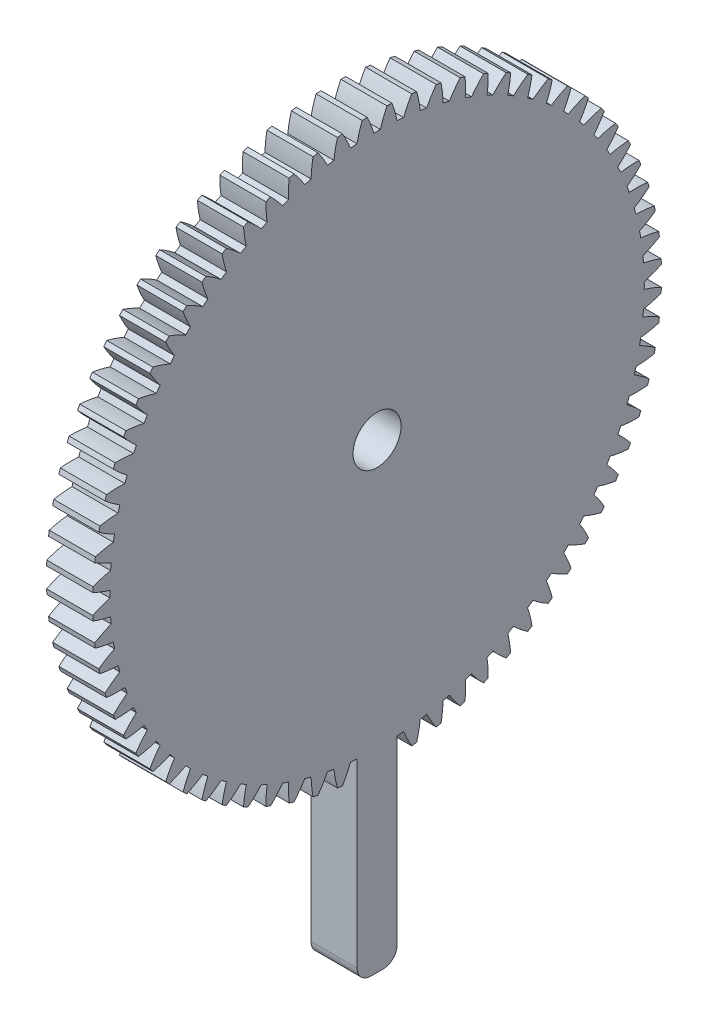
from build123d import *

# Parameters (mm, degrees)
SKETCH1_W           = 6.35
SKETCH1_H           = 39.158333333
CUT_EXTRUDE1_DEPTH  = 56.741121615
SKETCH5_R           = 3.302
CUT_EXTRUDE3_DEPTH  = 56.70763123
BOSS_EXTRUDE1_DEPTH = 6.35


with BuildPart() as part:
    # Sketch1 → Revolve1 (revolve)
    with BuildSketch(Plane.XY, mode=Mode.PRIVATE) as revolve1_sk:
        with Locations((3.175, 19.579166667)):
            Rectangle(SKETCH1_W, SKETCH1_H)
    revolve(revolve1_sk.sketch.rotate(Axis((-10, 0, 0), (1, 0, 0)), 90), axis=Axis((-10, 0, 0), (1, 0, 0)))

    # Sketch2 → Cut-Extrude1 (cut, through all)
    with BuildSketch(Plane.ZY):
        with BuildLine():
            ThreePointArc((0.453579929, 36.776403004), (0, 36.7792), (-0.453579929, 36.776403004))
            ThreePointArc((-0.453579929, 36.776403004), (-0.86587275, 37.987365832), (-1.378270139, 39.159485816))
            ThreePointArc((-1.378270139, 39.159485816), (0, 39.183733333), (1.378270139, 39.159485816))
            ThreePointArc((1.378270139, 39.159485816), (0.86587275, 37.987365832), (0.453579929, 36.776403004))
        make_face()
        with BuildLine():
            ThreePointArc((2.753420799, 36.675989783), (2.448239242, 37.918278219), (2.039948667, 39.130596307))
            ThreePointArc((2.039948667, 39.130596307), (3.415087382, 39.034627398), (4.785999477, 38.890347992))
            ThreePointArc((4.785999477, 38.890347992), (4.173394926, 37.767346654), (3.65712864, 36.596925592))
            ThreePointArc((3.65712864, 36.596925592), (3.205518494, 36.63924404), (2.753420799, 36.675989783))
        make_face()
        with BuildLine():
            ThreePointArc((5.939466332, 36.296450134), (5.743718654, 37.560609613), (5.442642232, 38.803899333))
            ThreePointArc((5.442642232, 38.803899333), (6.804183888, 38.588444379), (8.157304469, 38.325231137))
            ThreePointArc((8.157304469, 38.325231137), (7.449155048, 37.259895163), (6.832844394, 36.138923478))
            ThreePointArc((6.832844394, 36.138923478), (6.386641056, 36.22044131), (5.939466332, 36.296450134))
        make_face()
        with BuildLine():
            ThreePointArc((9.08030894, 35.640672583), (8.9954849, 36.917082088), (8.803914003, 38.181881255))
            ThreePointArc((8.803914003, 38.181881255), (10.141496445, 37.848579997), (11.466527448, 37.468436132))
            ThreePointArc((11.466527448, 37.468436132), (10.668222602, 36.468873372), (9.956558076, 35.405882335))
            ThreePointArc((9.956558076, 35.405882335), (9.519157424, 35.52597915), (9.08030894, 35.640672583))
        make_face()
        with BuildLine():
            ThreePointArc((12.152044914, 34.713647994), (12.178790073, 35.992593277), (12.098182672, 37.269276005))
            ThreePointArc((12.098182672, 37.269276005), (13.401626091, 36.820665068), (14.68848323, 36.326483704))
            ThreePointArc((14.68848323, 36.326483704), (13.80609854, 35.400301434), (13.004496339, 34.403381049))
            ThreePointArc((13.004496339, 34.403381049), (12.579227255, 34.561142838), (12.152044914, 34.713647994))
        make_face()
        with BuildLine():
            ThreePointArc((15.131296489, 33.522431583), (15.269407301, 34.794179099), (15.300376867, 36.073029062))
            ThreePointArc((15.300376867, 36.073029062), (16.55976127, 35.512522645), (17.798650786, 34.908064801))
            ThreePointArc((17.798650786, 34.908064801), (16.838901731, 34.062311826), (15.953462532, 33.13904926))
            ThreePointArc((15.953462532, 33.13904926), (15.543561572, 33.333275361), (15.131296489, 33.522431583))
        make_face()
        with BuildLine():
            ThreePointArc((17.99538976, 32.076089226), (18.243815118, 33.330960208), (18.386125954, 34.602244585))
            ThreePointArc((18.386125954, 34.602244585), (19.591866667, 33.934108482), (20.773359862, 33.223974446))
            ThreePointArc((20.773359862, 33.223974446), (19.743550714, 32.465087459), (18.781013243, 31.622509296))
            ThreePointArc((18.781013243, 31.622509296), (18.3896, 31.851721531), (17.99538976, 32.076089226))
        make_face()
        with BuildLine():
            ThreePointArc((20.72252725, 30.385628461), (21.079376487, 31.614072584), (21.331945522, 32.868116134))
            ThreePointArc((21.331945522, 32.868116134), (22.474866128, 32.097435263), (23.589971126, 31.287029585))
            ThreePointArc((23.589971126, 31.287029585), (22.497939353, 30.620784172), (21.465629103, 29.865302943))
            ThreePointArc((21.465629103, 29.865302943), (21.095682468, 30.127756867), (20.72252725, 30.385628461))
        make_face()
        with BuildLine():
            ThreePointArc((23.291953795, 28.463914717), (23.754511073, 29.656582779), (24.115416103, 30.883841473))
            ThreePointArc((24.115416103, 30.883841473), (25.186818288, 30.016481181), (26.227048465, 29.111971536))
            ThreePointArc((26.227048465, 29.111971536), (25.08110509, 28.543438229), (23.986878564, 27.8808036))
            ThreePointArc((23.986878564, 27.8808036), (23.641214054, 28.174501782), (23.291953795, 28.463914717))
        make_face()
        with BuildLine():
            ThreePointArc((25.684114508, 26.325573395), (26.248859486, 27.473388472), (26.715353807, 28.66452213))
            ThreePointArc((26.715353807, 28.66452213), (27.707083552, 27.707083552), (28.66452213, 26.715353807))
            ThreePointArc((28.66452213, 26.715353807), (27.473388472, 26.248859486), (26.325573395, 25.684114508))
            ThreePointArc((26.325573395, 25.684114508), (26.006821727, 26.006821727), (25.684114508, 26.325573395))
        make_face()
        with BuildLine():
            ThreePointArc((27.8808036, 23.986878564), (28.543438229, 25.08110509), (29.111971536, 26.227048465))
            ThreePointArc((29.111971536, 26.227048465), (30.016481181, 25.186818288), (30.883841473, 24.115416103))
            ThreePointArc((30.883841473, 24.115416103), (29.656582779, 23.754511073), (28.463914717, 23.291953795))
            ThreePointArc((28.463914717, 23.291953795), (28.174501782, 23.641214054), (27.8808036, 23.986878564))
        make_face()
        with BuildLine():
            ThreePointArc((29.865302943, 21.465629103), (30.620784172, 22.497939353), (31.287029585, 23.589971126))
            ThreePointArc((31.287029585, 23.589971126), (32.097435263, 22.474866128), (32.868116134, 21.331945522))
            ThreePointArc((32.868116134, 21.331945522), (31.614072584, 21.079376487), (30.385628461, 20.72252725))
            ThreePointArc((30.385628461, 20.72252725), (30.127756867, 21.095682468), (29.865302943, 21.465629103))
        make_face()
        with BuildLine():
            ThreePointArc((31.622509296, 18.781013243), (32.465087459, 19.743550714), (33.223974446, 20.773359862))
            ThreePointArc((33.223974446, 20.773359862), (33.934108482, 19.591866667), (34.602244585, 18.386125954))
            ThreePointArc((34.602244585, 18.386125954), (33.330960208, 18.243815118), (32.076089226, 17.99538976))
            ThreePointArc((32.076089226, 17.99538976), (31.851721531, 18.3896), (31.622509296, 18.781013243))
        make_face()
        with BuildLine():
            ThreePointArc((33.13904926, 15.953462532), (34.062311826, 16.838901731), (34.908064801, 17.798650786))
            ThreePointArc((34.908064801, 17.798650786), (35.512522645, 16.55976127), (36.073029062, 15.300376867))
            ThreePointArc((36.073029062, 15.300376867), (34.794179099, 15.269407301), (33.522431583, 15.131296489))
            ThreePointArc((33.522431583, 15.131296489), (33.333275361, 15.543561572), (33.13904926, 15.953462532))
        make_face()
        with BuildLine():
            ThreePointArc((34.403381049, 13.004496339), (35.400301434, 13.80609854), (36.326483704, 14.68848323))
            ThreePointArc((36.326483704, 14.68848323), (36.820665068, 13.401626091), (37.269276005, 12.098182672))
            ThreePointArc((37.269276005, 12.098182672), (35.992593277, 12.178790073), (34.713647994, 12.152044914))
            ThreePointArc((34.713647994, 12.152044914), (34.561142838, 12.579227255), (34.403381049, 13.004496339))
        make_face()
        with BuildLine():
            ThreePointArc((35.405882335, 9.956558076), (36.468873372, 10.668222602), (37.468436132, 11.466527448))
            ThreePointArc((37.468436132, 11.466527448), (37.848579997, 10.141496445), (38.181881255, 8.803914003))
            ThreePointArc((38.181881255, 8.803914003), (36.917082088, 8.9954849), (35.640672583, 9.08030894))
            ThreePointArc((35.640672583, 9.08030894), (35.52597915, 9.519157424), (35.405882335, 9.956558076))
        make_face()
        with BuildLine():
            ThreePointArc((36.138923478, 6.832844394), (37.259895163, 7.449155048), (38.325231137, 8.157304469))
            ThreePointArc((38.325231137, 8.157304469), (38.588444379, 6.804183888), (38.803899333, 5.442642232))
            ThreePointArc((38.803899333, 5.442642232), (37.560609613, 5.743718654), (36.296450134, 5.939466332))
            ThreePointArc((36.296450134, 5.939466332), (36.22044131, 6.386641056), (36.138923478, 6.832844394))
        make_face()
        with BuildLine():
            ThreePointArc((36.596925592, 3.65712864), (37.767346654, 4.173394926), (38.890347992, 4.785999477))
            ThreePointArc((38.890347992, 4.785999477), (39.034627398, 3.415087382), (39.130596307, 2.039948667))
            ThreePointArc((39.130596307, 2.039948667), (37.918278219, 2.448239242), (36.675989783, 2.753420799))
            ThreePointArc((36.675989783, 2.753420799), (36.63924404, 3.205518494), (36.596925592, 3.65712864))
        make_face()
        with BuildLine():
            ThreePointArc((36.776403004, 0.453579929), (37.987365832, 0.86587275), (39.159485816, 1.378270139))
            ThreePointArc((39.159485816, 1.378270139), (39.183733333, 0), (39.159485816, -1.378270139))
            ThreePointArc((39.159485816, -1.378270139), (37.987365832, -0.86587275), (36.776403004, -0.453579929))
            ThreePointArc((36.776403004, -0.453579929), (36.7792, 0), (36.776403004, 0.453579929))
        make_face()
        with BuildLine():
            ThreePointArc((36.675989783, -2.753420799), (37.918278219, -2.448239242), (39.130596307, -2.039948667))
            ThreePointArc((39.130596307, -2.039948667), (39.034627398, -3.415087382), (38.890347992, -4.785999477))
            ThreePointArc((38.890347992, -4.785999477), (37.767346654, -4.173394926), (36.596925592, -3.65712864))
            ThreePointArc((36.596925592, -3.65712864), (36.63924404, -3.205518494), (36.675989783, -2.753420799))
        make_face()
        with BuildLine():
            ThreePointArc((36.296450134, -5.939466332), (37.560609613, -5.743718654), (38.803899333, -5.442642232))
            ThreePointArc((38.803899333, -5.442642232), (38.588444379, -6.804183888), (38.325231137, -8.157304469))
            ThreePointArc((38.325231137, -8.157304469), (37.259895163, -7.449155048), (36.138923478, -6.832844394))
            ThreePointArc((36.138923478, -6.832844394), (36.22044131, -6.386641056), (36.296450134, -5.939466332))
        make_face()
        with BuildLine():
            ThreePointArc((35.640672583, -9.08030894), (36.917082088, -8.9954849), (38.181881255, -8.803914003))
            ThreePointArc((38.181881255, -8.803914003), (37.848579997, -10.141496445), (37.468436132, -11.466527448))
            ThreePointArc((37.468436132, -11.466527448), (36.468873372, -10.668222602), (35.405882335, -9.956558076))
            ThreePointArc((35.405882335, -9.956558076), (35.52597915, -9.519157424), (35.640672583, -9.08030894))
        make_face()
        with BuildLine():
            ThreePointArc((34.713647994, -12.152044914), (35.992593277, -12.178790073), (37.269276005, -12.098182672))
            ThreePointArc((37.269276005, -12.098182672), (36.820665068, -13.401626091), (36.326483704, -14.68848323))
            ThreePointArc((36.326483704, -14.68848323), (35.400301434, -13.80609854), (34.403381049, -13.004496339))
            ThreePointArc((34.403381049, -13.004496339), (34.561142838, -12.579227255), (34.713647994, -12.152044914))
        make_face()
        with BuildLine():
            ThreePointArc((33.522431583, -15.131296489), (34.794179099, -15.269407301), (36.073029062, -15.300376867))
            ThreePointArc((36.073029062, -15.300376867), (35.512522645, -16.55976127), (34.908064801, -17.798650786))
            ThreePointArc((34.908064801, -17.798650786), (34.062311826, -16.838901731), (33.13904926, -15.953462532))
            ThreePointArc((33.13904926, -15.953462532), (33.333275361, -15.543561572), (33.522431583, -15.131296489))
        make_face()
        with BuildLine():
            ThreePointArc((32.076089226, -17.99538976), (33.330960208, -18.243815118), (34.602244585, -18.386125954))
            ThreePointArc((34.602244585, -18.386125954), (33.934108482, -19.591866667), (33.223974446, -20.773359862))
            ThreePointArc((33.223974446, -20.773359862), (32.465087459, -19.743550714), (31.622509296, -18.781013243))
            ThreePointArc((31.622509296, -18.781013243), (31.851721531, -18.3896), (32.076089226, -17.99538976))
        make_face()
        with BuildLine():
            ThreePointArc((30.385628461, -20.72252725), (31.614072584, -21.079376487), (32.868116134, -21.331945522))
            ThreePointArc((32.868116134, -21.331945522), (32.097435263, -22.474866128), (31.287029585, -23.589971126))
            ThreePointArc((31.287029585, -23.589971126), (30.620784172, -22.497939353), (29.865302943, -21.465629103))
            ThreePointArc((29.865302943, -21.465629103), (30.127756867, -21.095682468), (30.385628461, -20.72252725))
        make_face()
        with BuildLine():
            ThreePointArc((28.463914717, -23.291953795), (29.656582779, -23.754511073), (30.883841473, -24.115416103))
            ThreePointArc((30.883841473, -24.115416103), (30.016481181, -25.186818288), (29.111971536, -26.227048465))
            ThreePointArc((29.111971536, -26.227048465), (28.543438229, -25.08110509), (27.8808036, -23.986878564))
            ThreePointArc((27.8808036, -23.986878564), (28.174501782, -23.641214054), (28.463914717, -23.291953795))
        make_face()
        with BuildLine():
            ThreePointArc((26.325573395, -25.684114508), (27.473388472, -26.248859486), (28.66452213, -26.715353807))
            ThreePointArc((28.66452213, -26.715353807), (27.707083552, -27.707083552), (26.715353807, -28.66452213))
            ThreePointArc((26.715353807, -28.66452213), (26.248859486, -27.473388472), (25.684114508, -26.325573395))
            ThreePointArc((25.684114508, -26.325573395), (26.006821727, -26.006821727), (26.325573395, -25.684114508))
        make_face()
        with BuildLine():
            ThreePointArc((23.986878564, -27.8808036), (25.08110509, -28.543438229), (26.227048465, -29.111971536))
            ThreePointArc((26.227048465, -29.111971536), (25.186818288, -30.016481181), (24.115416103, -30.883841473))
            ThreePointArc((24.115416103, -30.883841473), (23.754511073, -29.656582779), (23.291953795, -28.463914717))
            ThreePointArc((23.291953795, -28.463914717), (23.641214054, -28.174501782), (23.986878564, -27.8808036))
        make_face()
        with BuildLine():
            ThreePointArc((21.465629103, -29.865302943), (22.497939353, -30.620784172), (23.589971126, -31.287029585))
            ThreePointArc((23.589971126, -31.287029585), (22.474866128, -32.097435263), (21.331945522, -32.868116134))
            ThreePointArc((21.331945522, -32.868116134), (21.079376487, -31.614072584), (20.72252725, -30.385628461))
            ThreePointArc((20.72252725, -30.385628461), (21.095682468, -30.127756867), (21.465629103, -29.865302943))
        make_face()
        with BuildLine():
            ThreePointArc((18.781013243, -31.622509296), (19.743550714, -32.465087459), (20.773359862, -33.223974446))
            ThreePointArc((20.773359862, -33.223974446), (19.591866667, -33.934108482), (18.386125954, -34.602244585))
            ThreePointArc((18.386125954, -34.602244585), (18.243815118, -33.330960208), (17.99538976, -32.076089226))
            ThreePointArc((17.99538976, -32.076089226), (18.3896, -31.851721531), (18.781013243, -31.622509296))
        make_face()
        with BuildLine():
            ThreePointArc((15.953462532, -33.13904926), (16.838901731, -34.062311826), (17.798650786, -34.908064801))
            ThreePointArc((17.798650786, -34.908064801), (16.55976127, -35.512522645), (15.300376867, -36.073029062))
            ThreePointArc((15.300376867, -36.073029062), (15.269407301, -34.794179099), (15.131296489, -33.522431583))
            ThreePointArc((15.131296489, -33.522431583), (15.543561572, -33.333275361), (15.953462532, -33.13904926))
        make_face()
        with BuildLine():
            ThreePointArc((13.004496339, -34.403381049), (13.80609854, -35.400301434), (14.68848323, -36.326483704))
            ThreePointArc((14.68848323, -36.326483704), (13.401626091, -36.820665068), (12.098182672, -37.269276005))
            ThreePointArc((12.098182672, -37.269276005), (12.178790073, -35.992593277), (12.152044914, -34.713647994))
            ThreePointArc((12.152044914, -34.713647994), (12.579227255, -34.561142838), (13.004496339, -34.403381049))
        make_face()
        with BuildLine():
            ThreePointArc((9.956558076, -35.405882335), (10.668222602, -36.468873372), (11.466527448, -37.468436132))
            ThreePointArc((11.466527448, -37.468436132), (10.141496445, -37.848579997), (8.803914003, -38.181881255))
            ThreePointArc((8.803914003, -38.181881255), (8.9954849, -36.917082088), (9.08030894, -35.640672583))
            ThreePointArc((9.08030894, -35.640672583), (9.519157424, -35.52597915), (9.956558076, -35.405882335))
        make_face()
        with BuildLine():
            ThreePointArc((6.832844394, -36.138923478), (7.449155048, -37.259895163), (8.157304469, -38.325231137))
            ThreePointArc((8.157304469, -38.325231137), (6.804183888, -38.588444379), (5.442642232, -38.803899333))
            ThreePointArc((5.442642232, -38.803899333), (5.743718654, -37.560609613), (5.939466332, -36.296450134))
            ThreePointArc((5.939466332, -36.296450134), (6.386641056, -36.22044131), (6.832844394, -36.138923478))
        make_face()
        with BuildLine():
            ThreePointArc((3.65712864, -36.596925592), (4.173394926, -37.767346654), (4.785999477, -38.890347992))
            ThreePointArc((4.785999477, -38.890347992), (3.415087382, -39.034627398), (2.039948667, -39.130596307))
            ThreePointArc((2.039948667, -39.130596307), (2.448239242, -37.918278219), (2.753420799, -36.675989783))
            ThreePointArc((2.753420799, -36.675989783), (3.205518494, -36.63924404), (3.65712864, -36.596925592))
        make_face()
        with BuildLine():
            ThreePointArc((0.453579929, -36.776403004), (0.86587275, -37.987365832), (1.378270139, -39.159485816))
            ThreePointArc((1.378270139, -39.159485816), (0, -39.183733333), (-1.378270139, -39.159485816))
            ThreePointArc((-1.378270139, -39.159485816), (-0.86587275, -37.987365832), (-0.453579929, -36.776403004))
            ThreePointArc((-0.453579929, -36.776403004), (0, -36.7792), (0.453579929, -36.776403004))
        make_face()
        with BuildLine():
            ThreePointArc((-2.753420799, -36.675989783), (-2.448239242, -37.918278219), (-2.039948667, -39.130596307))
            ThreePointArc((-2.039948667, -39.130596307), (-3.415087382, -39.034627398), (-4.785999477, -38.890347992))
            ThreePointArc((-4.785999477, -38.890347992), (-4.173394926, -37.767346654), (-3.65712864, -36.596925592))
            ThreePointArc((-3.65712864, -36.596925592), (-3.205518494, -36.63924404), (-2.753420799, -36.675989783))
        make_face()
        with BuildLine():
            ThreePointArc((-5.939466332, -36.296450134), (-5.743718654, -37.560609613), (-5.442642232, -38.803899333))
            ThreePointArc((-5.442642232, -38.803899333), (-6.804183888, -38.588444379), (-8.157304469, -38.325231137))
            ThreePointArc((-8.157304469, -38.325231137), (-7.449155048, -37.259895163), (-6.832844394, -36.138923478))
            ThreePointArc((-6.832844394, -36.138923478), (-6.386641056, -36.22044131), (-5.939466332, -36.296450134))
        make_face()
        with BuildLine():
            ThreePointArc((-9.08030894, -35.640672583), (-8.9954849, -36.917082088), (-8.803914003, -38.181881255))
            ThreePointArc((-8.803914003, -38.181881255), (-10.141496445, -37.848579997), (-11.466527448, -37.468436132))
            ThreePointArc((-11.466527448, -37.468436132), (-10.668222602, -36.468873372), (-9.956558076, -35.405882335))
            ThreePointArc((-9.956558076, -35.405882335), (-9.519157424, -35.52597915), (-9.08030894, -35.640672583))
        make_face()
        with BuildLine():
            ThreePointArc((-12.152044914, -34.713647994), (-12.178790073, -35.992593277), (-12.098182672, -37.269276005))
            ThreePointArc((-12.098182672, -37.269276005), (-13.401626091, -36.820665068), (-14.68848323, -36.326483704))
            ThreePointArc((-14.68848323, -36.326483704), (-13.80609854, -35.400301434), (-13.004496339, -34.403381049))
            ThreePointArc((-13.004496339, -34.403381049), (-12.579227255, -34.561142838), (-12.152044914, -34.713647994))
        make_face()
        with BuildLine():
            ThreePointArc((-15.131296489, -33.522431583), (-15.269407301, -34.794179099), (-15.300376867, -36.073029062))
            ThreePointArc((-15.300376867, -36.073029062), (-16.55976127, -35.512522645), (-17.798650786, -34.908064801))
            ThreePointArc((-17.798650786, -34.908064801), (-16.838901731, -34.062311826), (-15.953462532, -33.13904926))
            ThreePointArc((-15.953462532, -33.13904926), (-15.543561572, -33.333275361), (-15.131296489, -33.522431583))
        make_face()
        with BuildLine():
            ThreePointArc((-17.99538976, -32.076089226), (-18.243815118, -33.330960208), (-18.386125954, -34.602244585))
            ThreePointArc((-18.386125954, -34.602244585), (-19.591866667, -33.934108482), (-20.773359862, -33.223974446))
            ThreePointArc((-20.773359862, -33.223974446), (-19.743550714, -32.465087459), (-18.781013243, -31.622509296))
            ThreePointArc((-18.781013243, -31.622509296), (-18.3896, -31.851721531), (-17.99538976, -32.076089226))
        make_face()
        with BuildLine():
            ThreePointArc((-20.72252725, -30.385628461), (-21.079376487, -31.614072584), (-21.331945522, -32.868116134))
            ThreePointArc((-21.331945522, -32.868116134), (-22.474866128, -32.097435263), (-23.589971126, -31.287029585))
            ThreePointArc((-23.589971126, -31.287029585), (-22.497939353, -30.620784172), (-21.465629103, -29.865302943))
            ThreePointArc((-21.465629103, -29.865302943), (-21.095682468, -30.127756867), (-20.72252725, -30.385628461))
        make_face()
        with BuildLine():
            ThreePointArc((-23.291953795, -28.463914717), (-23.754511073, -29.656582779), (-24.115416103, -30.883841473))
            ThreePointArc((-24.115416103, -30.883841473), (-25.186818288, -30.016481181), (-26.227048465, -29.111971536))
            ThreePointArc((-26.227048465, -29.111971536), (-25.08110509, -28.543438229), (-23.986878564, -27.8808036))
            ThreePointArc((-23.986878564, -27.8808036), (-23.641214054, -28.174501782), (-23.291953795, -28.463914717))
        make_face()
        with BuildLine():
            ThreePointArc((-25.684114508, -26.325573395), (-26.248859486, -27.473388472), (-26.715353807, -28.66452213))
            ThreePointArc((-26.715353807, -28.66452213), (-27.707083552, -27.707083552), (-28.66452213, -26.715353807))
            ThreePointArc((-28.66452213, -26.715353807), (-27.473388472, -26.248859486), (-26.325573395, -25.684114508))
            ThreePointArc((-26.325573395, -25.684114508), (-26.006821727, -26.006821727), (-25.684114508, -26.325573395))
        make_face()
        with BuildLine():
            ThreePointArc((-27.8808036, -23.986878564), (-28.543438229, -25.08110509), (-29.111971536, -26.227048465))
            ThreePointArc((-29.111971536, -26.227048465), (-30.016481181, -25.186818288), (-30.883841473, -24.115416103))
            ThreePointArc((-30.883841473, -24.115416103), (-29.656582779, -23.754511073), (-28.463914717, -23.291953795))
            ThreePointArc((-28.463914717, -23.291953795), (-28.174501782, -23.641214054), (-27.8808036, -23.986878564))
        make_face()
        with BuildLine():
            ThreePointArc((-29.865302943, -21.465629103), (-30.620784172, -22.497939353), (-31.287029585, -23.589971126))
            ThreePointArc((-31.287029585, -23.589971126), (-32.097435263, -22.474866128), (-32.868116134, -21.331945522))
            ThreePointArc((-32.868116134, -21.331945522), (-31.614072584, -21.079376487), (-30.385628461, -20.72252725))
            ThreePointArc((-30.385628461, -20.72252725), (-30.127756867, -21.095682468), (-29.865302943, -21.465629103))
        make_face()
        with BuildLine():
            ThreePointArc((-31.622509296, -18.781013243), (-32.465087459, -19.743550714), (-33.223974446, -20.773359862))
            ThreePointArc((-33.223974446, -20.773359862), (-33.934108482, -19.591866667), (-34.602244585, -18.386125954))
            ThreePointArc((-34.602244585, -18.386125954), (-33.330960208, -18.243815118), (-32.076089226, -17.99538976))
            ThreePointArc((-32.076089226, -17.99538976), (-31.851721531, -18.3896), (-31.622509296, -18.781013243))
        make_face()
        with BuildLine():
            ThreePointArc((-33.13904926, -15.953462532), (-34.062311826, -16.838901731), (-34.908064801, -17.798650786))
            ThreePointArc((-34.908064801, -17.798650786), (-35.512522645, -16.55976127), (-36.073029062, -15.300376867))
            ThreePointArc((-36.073029062, -15.300376867), (-34.794179099, -15.269407301), (-33.522431583, -15.131296489))
            ThreePointArc((-33.522431583, -15.131296489), (-33.333275361, -15.543561572), (-33.13904926, -15.953462532))
        make_face()
        with BuildLine():
            ThreePointArc((-34.403381049, -13.004496339), (-35.400301434, -13.80609854), (-36.326483704, -14.68848323))
            ThreePointArc((-36.326483704, -14.68848323), (-36.820665068, -13.401626091), (-37.269276005, -12.098182672))
            ThreePointArc((-37.269276005, -12.098182672), (-35.992593277, -12.178790073), (-34.713647994, -12.152044914))
            ThreePointArc((-34.713647994, -12.152044914), (-34.561142838, -12.579227255), (-34.403381049, -13.004496339))
        make_face()
        with BuildLine():
            ThreePointArc((-35.405882335, -9.956558076), (-36.468873372, -10.668222602), (-37.468436132, -11.466527448))
            ThreePointArc((-37.468436132, -11.466527448), (-37.848579997, -10.141496445), (-38.181881255, -8.803914003))
            ThreePointArc((-38.181881255, -8.803914003), (-36.917082088, -8.9954849), (-35.640672583, -9.08030894))
            ThreePointArc((-35.640672583, -9.08030894), (-35.52597915, -9.519157424), (-35.405882335, -9.956558076))
        make_face()
        with BuildLine():
            ThreePointArc((-36.138923478, -6.832844394), (-37.259895163, -7.449155048), (-38.325231137, -8.157304469))
            ThreePointArc((-38.325231137, -8.157304469), (-38.588444379, -6.804183888), (-38.803899333, -5.442642232))
            ThreePointArc((-38.803899333, -5.442642232), (-37.560609613, -5.743718654), (-36.296450134, -5.939466332))
            ThreePointArc((-36.296450134, -5.939466332), (-36.22044131, -6.386641056), (-36.138923478, -6.832844394))
        make_face()
        with BuildLine():
            ThreePointArc((-36.596925592, -3.65712864), (-37.767346654, -4.173394926), (-38.890347992, -4.785999477))
            ThreePointArc((-38.890347992, -4.785999477), (-39.034627398, -3.415087382), (-39.130596307, -2.039948667))
            ThreePointArc((-39.130596307, -2.039948667), (-37.918278219, -2.448239242), (-36.675989783, -2.753420799))
            ThreePointArc((-36.675989783, -2.753420799), (-36.63924404, -3.205518494), (-36.596925592, -3.65712864))
        make_face()
        with BuildLine():
            ThreePointArc((-36.776403004, -0.453579929), (-37.987365832, -0.86587275), (-39.159485816, -1.378270139))
            ThreePointArc((-39.159485816, -1.378270139), (-39.183733333, 0), (-39.159485816, 1.378270139))
            ThreePointArc((-39.159485816, 1.378270139), (-37.987365832, 0.86587275), (-36.776403004, 0.453579929))
            ThreePointArc((-36.776403004, 0.453579929), (-36.7792, 0), (-36.776403004, -0.453579929))
        make_face()
        with BuildLine():
            ThreePointArc((-36.675989783, 2.753420799), (-37.918278219, 2.448239242), (-39.130596307, 2.039948667))
            ThreePointArc((-39.130596307, 2.039948667), (-39.034627398, 3.415087382), (-38.890347992, 4.785999477))
            ThreePointArc((-38.890347992, 4.785999477), (-37.767346654, 4.173394926), (-36.596925592, 3.65712864))
            ThreePointArc((-36.596925592, 3.65712864), (-36.63924404, 3.205518494), (-36.675989783, 2.753420799))
        make_face()
        with BuildLine():
            ThreePointArc((-36.296450134, 5.939466332), (-37.560609613, 5.743718654), (-38.803899333, 5.442642232))
            ThreePointArc((-38.803899333, 5.442642232), (-38.588444379, 6.804183888), (-38.325231137, 8.157304469))
            ThreePointArc((-38.325231137, 8.157304469), (-37.259895163, 7.449155048), (-36.138923478, 6.832844394))
            ThreePointArc((-36.138923478, 6.832844394), (-36.22044131, 6.386641056), (-36.296450134, 5.939466332))
        make_face()
        with BuildLine():
            ThreePointArc((-35.640672583, 9.08030894), (-36.917082088, 8.9954849), (-38.181881255, 8.803914003))
            ThreePointArc((-38.181881255, 8.803914003), (-37.848579997, 10.141496445), (-37.468436132, 11.466527448))
            ThreePointArc((-37.468436132, 11.466527448), (-36.468873372, 10.668222602), (-35.405882335, 9.956558076))
            ThreePointArc((-35.405882335, 9.956558076), (-35.52597915, 9.519157424), (-35.640672583, 9.08030894))
        make_face()
        with BuildLine():
            ThreePointArc((-34.713647994, 12.152044914), (-35.992593277, 12.178790073), (-37.269276005, 12.098182672))
            ThreePointArc((-37.269276005, 12.098182672), (-36.820665068, 13.401626091), (-36.326483704, 14.68848323))
            ThreePointArc((-36.326483704, 14.68848323), (-35.400301434, 13.80609854), (-34.403381049, 13.004496339))
            ThreePointArc((-34.403381049, 13.004496339), (-34.561142838, 12.579227255), (-34.713647994, 12.152044914))
        make_face()
        with BuildLine():
            ThreePointArc((-33.522431583, 15.131296489), (-34.794179099, 15.269407301), (-36.073029062, 15.300376867))
            ThreePointArc((-36.073029062, 15.300376867), (-35.512522645, 16.55976127), (-34.908064801, 17.798650786))
            ThreePointArc((-34.908064801, 17.798650786), (-34.062311826, 16.838901731), (-33.13904926, 15.953462532))
            ThreePointArc((-33.13904926, 15.953462532), (-33.333275361, 15.543561572), (-33.522431583, 15.131296489))
        make_face()
        with BuildLine():
            ThreePointArc((-32.076089226, 17.99538976), (-33.330960208, 18.243815118), (-34.602244585, 18.386125954))
            ThreePointArc((-34.602244585, 18.386125954), (-33.934108482, 19.591866667), (-33.223974446, 20.773359862))
            ThreePointArc((-33.223974446, 20.773359862), (-32.465087459, 19.743550714), (-31.622509296, 18.781013243))
            ThreePointArc((-31.622509296, 18.781013243), (-31.851721531, 18.3896), (-32.076089226, 17.99538976))
        make_face()
        with BuildLine():
            ThreePointArc((-30.385628461, 20.72252725), (-31.614072584, 21.079376487), (-32.868116134, 21.331945522))
            ThreePointArc((-32.868116134, 21.331945522), (-32.097435263, 22.474866128), (-31.287029585, 23.589971126))
            ThreePointArc((-31.287029585, 23.589971126), (-30.620784172, 22.497939353), (-29.865302943, 21.465629103))
            ThreePointArc((-29.865302943, 21.465629103), (-30.127756867, 21.095682468), (-30.385628461, 20.72252725))
        make_face()
        with BuildLine():
            ThreePointArc((-28.463914717, 23.291953795), (-29.656582779, 23.754511073), (-30.883841473, 24.115416103))
            ThreePointArc((-30.883841473, 24.115416103), (-30.016481181, 25.186818288), (-29.111971536, 26.227048465))
            ThreePointArc((-29.111971536, 26.227048465), (-28.543438229, 25.08110509), (-27.8808036, 23.986878564))
            ThreePointArc((-27.8808036, 23.986878564), (-28.174501782, 23.641214054), (-28.463914717, 23.291953795))
        make_face()
        with BuildLine():
            ThreePointArc((-26.325573395, 25.684114508), (-27.473388472, 26.248859486), (-28.66452213, 26.715353807))
            ThreePointArc((-28.66452213, 26.715353807), (-27.707083552, 27.707083552), (-26.715353807, 28.66452213))
            ThreePointArc((-26.715353807, 28.66452213), (-26.248859486, 27.473388472), (-25.684114508, 26.325573395))
            ThreePointArc((-25.684114508, 26.325573395), (-26.006821727, 26.006821727), (-26.325573395, 25.684114508))
        make_face()
        with BuildLine():
            ThreePointArc((-23.986878564, 27.8808036), (-25.08110509, 28.543438229), (-26.227048465, 29.111971536))
            ThreePointArc((-26.227048465, 29.111971536), (-25.186818288, 30.016481181), (-24.115416103, 30.883841473))
            ThreePointArc((-24.115416103, 30.883841473), (-23.754511073, 29.656582779), (-23.291953795, 28.463914717))
            ThreePointArc((-23.291953795, 28.463914717), (-23.641214054, 28.174501782), (-23.986878564, 27.8808036))
        make_face()
        with BuildLine():
            ThreePointArc((-21.465629103, 29.865302943), (-22.497939353, 30.620784172), (-23.589971126, 31.287029585))
            ThreePointArc((-23.589971126, 31.287029585), (-22.474866128, 32.097435263), (-21.331945522, 32.868116134))
            ThreePointArc((-21.331945522, 32.868116134), (-21.079376487, 31.614072584), (-20.72252725, 30.385628461))
            ThreePointArc((-20.72252725, 30.385628461), (-21.095682468, 30.127756867), (-21.465629103, 29.865302943))
        make_face()
        with BuildLine():
            ThreePointArc((-18.781013243, 31.622509296), (-19.743550714, 32.465087459), (-20.773359862, 33.223974446))
            ThreePointArc((-20.773359862, 33.223974446), (-19.591866667, 33.934108482), (-18.386125954, 34.602244585))
            ThreePointArc((-18.386125954, 34.602244585), (-18.243815118, 33.330960208), (-17.99538976, 32.076089226))
            ThreePointArc((-17.99538976, 32.076089226), (-18.3896, 31.851721531), (-18.781013243, 31.622509296))
        make_face()
        with BuildLine():
            ThreePointArc((-15.953462532, 33.13904926), (-16.838901731, 34.062311826), (-17.798650786, 34.908064801))
            ThreePointArc((-17.798650786, 34.908064801), (-16.55976127, 35.512522645), (-15.300376867, 36.073029062))
            ThreePointArc((-15.300376867, 36.073029062), (-15.269407301, 34.794179099), (-15.131296489, 33.522431583))
            ThreePointArc((-15.131296489, 33.522431583), (-15.543561572, 33.333275361), (-15.953462532, 33.13904926))
        make_face()
        with BuildLine():
            ThreePointArc((-13.004496339, 34.403381049), (-13.80609854, 35.400301434), (-14.68848323, 36.326483704))
            ThreePointArc((-14.68848323, 36.326483704), (-13.401626091, 36.820665068), (-12.098182672, 37.269276005))
            ThreePointArc((-12.098182672, 37.269276005), (-12.178790073, 35.992593277), (-12.152044914, 34.713647994))
            ThreePointArc((-12.152044914, 34.713647994), (-12.579227255, 34.561142838), (-13.004496339, 34.403381049))
        make_face()
        with BuildLine():
            ThreePointArc((-9.956558076, 35.405882335), (-10.668222602, 36.468873372), (-11.466527448, 37.468436132))
            ThreePointArc((-11.466527448, 37.468436132), (-10.141496445, 37.848579997), (-8.803914003, 38.181881255))
            ThreePointArc((-8.803914003, 38.181881255), (-8.9954849, 36.917082088), (-9.08030894, 35.640672583))
            ThreePointArc((-9.08030894, 35.640672583), (-9.519157424, 35.52597915), (-9.956558076, 35.405882335))
        make_face()
        with BuildLine():
            ThreePointArc((-6.832844394, 36.138923478), (-7.449155048, 37.259895163), (-8.157304469, 38.325231137))
            ThreePointArc((-8.157304469, 38.325231137), (-6.804183888, 38.588444379), (-5.442642232, 38.803899333))
            ThreePointArc((-5.442642232, 38.803899333), (-5.743718654, 37.560609613), (-5.939466332, 36.296450134))
            ThreePointArc((-5.939466332, 36.296450134), (-6.386641056, 36.22044131), (-6.832844394, 36.138923478))
        make_face()
        with BuildLine():
            ThreePointArc((-3.65712864, 36.596925592), (-4.173394926, 37.767346654), (-4.785999477, 38.890347992))
            ThreePointArc((-4.785999477, 38.890347992), (-3.415087382, 39.034627398), (-2.039948667, 39.130596307))
            ThreePointArc((-2.039948667, 39.130596307), (-2.448239242, 37.918278219), (-2.753420799, 36.675989783))
            ThreePointArc((-2.753420799, 36.675989783), (-3.205518494, 36.63924404), (-3.65712864, 36.596925592))
        make_face()
    extrude(amount=-CUT_EXTRUDE1_DEPTH, mode=Mode.SUBTRACT)

    # Sketch5 → Cut-Extrude3 (cut, through all)
    with BuildSketch(Plane.ZY):
        Circle(SKETCH5_R)
    extrude(amount=-CUT_EXTRUDE3_DEPTH, mode=Mode.SUBTRACT)

    # Sketch6 → Boss-Extrude1 (add)
    with BuildSketch(Plane.ZY):
        with BuildLine():
            Line((-0.848420799, -63.5), (0.848420799, -63.5))
            ThreePointArc((0.848420799, -63.5), (2.195459217, -62.942038418), (2.753420799, -61.595))
            Line((2.753420799, -61.595), (2.753420799, -35.56))
            Line((2.753420799, -35.56), (-2.753420799, -35.56))
            Line((-2.753420799, -35.56), (-2.753420799, -61.595))
            ThreePointArc((-2.753420799, -61.595), (-2.195459217, -62.942038418), (-0.848420799, -63.5))
        make_face()
    extrude(amount=-BOSS_EXTRUDE1_DEPTH)


solid = part.part
